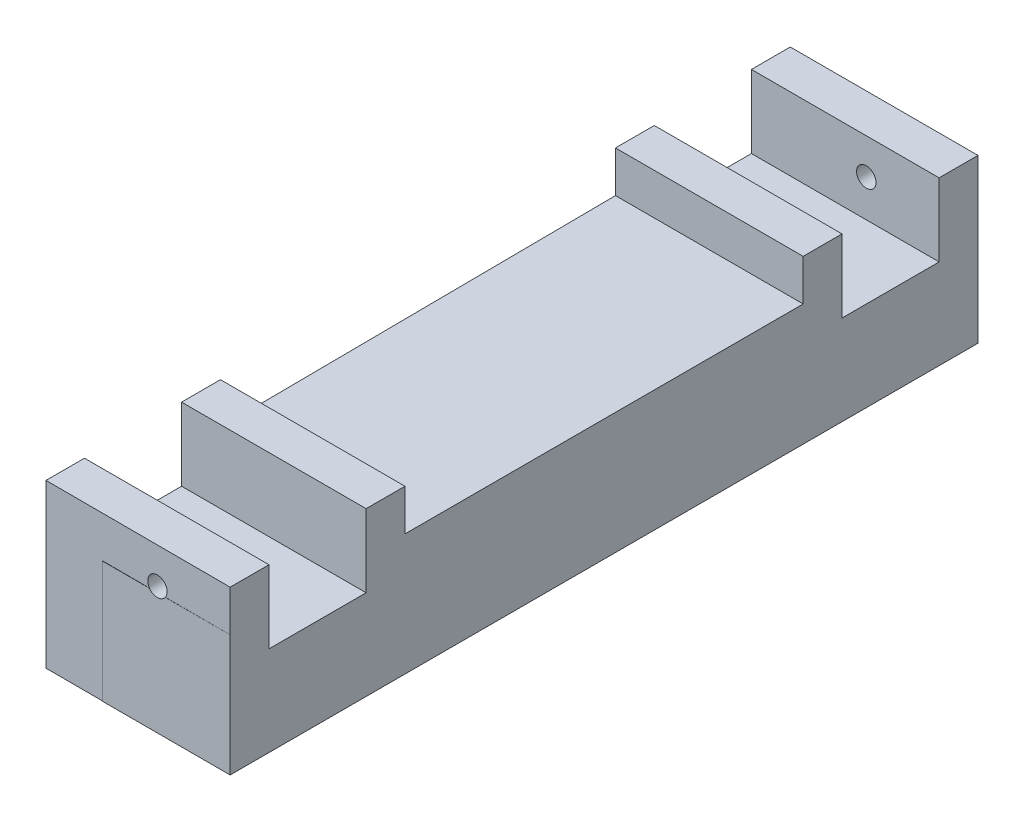
from build123d import *

# Parameters (mm, degrees)
EXTRUDE_1_DEPTH           = 30
SKETCH_2_W                = 20
SKETCH_2_H                = 15
SKETCH_2_W_2              = 70
SKETCH_2_H_2              = 10
EXTRUDE_4_DEPTH           = 70
SKETCH_5_R                = 2.8
CUT_EXTRUDE_3_DEPTH       = 5
SKETCH_6_R                = 2.8
CUT_EXTRUDE_4_DEPTH       = 5
PATTERN_LINEAR_1_COUNT    = 3
PATTERN_LINEAR_1_PITCH    = 19
SKETCH_14_W               = 30
SKETCH_14_H               = 20
EXTRUDE_16_DEPTH          = 8.5
EXTRUDE_17_DEPTH          = 8.5
EXTRUDE_18_DEPTH          = 8.5
SKETCH_15_W               = 140
SKETCH_15_H               = 160
EXTRUDE_21_DEPTH          = 10
SKETCH_17_W               = 140
SKETCH_17_H               = 160
EXTRUDE_22_DEPTH          = 15
CUT_EXTRUDE_8_REACH       = 328.336
SKETCH_20_R               = 2
CUT_EXTRUDE_10_REACH      = 267.273
CUT_EXTRUDE_11_REACH      = 267.358
SKETCH_22_R               = 2
SKETCH_23_R               = 2.8
CUT_EXTRUDE_12_DEPTH      = 5
SKETCH_24_R               = 1.9
CUT_EXTRUDE_13_DEPTH      = 5
CUT_EXTRUDE_16_DEPTH      = 251.685617404
CUT_EXTRUDE_16_DEPTH_BACK = 251.685617404
CUT_EXTRUDE_17_DEPTH      = 15


with BuildPart() as part:
    # 草图1 → 凸台-拉伸1 (new body)
    with BuildSketch(Plane(origin=(0, 0, 0), x_dir=(0, 0, -1), z_dir=(1, 0, 0))):
        Polygon((-20.255776875, 11.348042253), (-20.255776875, -3.651957747), (-0.255776875, -3.651957747), (-0.255776875, 11.348042253), (97.744223125, 11.348042253), (97.744223125, -3.651957747), (117.744223125, -3.651957747), (117.744223125, 11.348042253), (125.744223125, 11.348042253), (125.744223125, -13.651957747), (-28.255776875, -13.651957747), (-28.255776875, 11.348042253), align=None)
    extrude(amount=EXTRUDE_1_DEPTH)

    # 草图2 → 凸台-拉伸4 (add)
    with BuildSketch(Plane.ZY):
        Polygon((-125.744223125, 11.348042253), (-117.744223125, 11.348042253), (-117.744223125, 16.348042253), (-132.744223125, 16.348042253), (-132.744223125, -13.651957747), (-125.744223125, -13.651957747), align=None)
        Polygon((-117.744223125, -13.651957747), (-117.744223125, -3.651957747), (-117.744223125, 11.348042253), (-125.744223125, 11.348042253), (-125.744223125, -13.651957747), align=None)
        Polygon((-97.744223125, -3.651957747), (-117.744223125, -3.651957747), (-117.744223125, -13.651957747), (28.255776875, -13.651957747), (28.255776875, 11.348042253), (20.255776875, 11.348042253), (20.255776875, -3.651957747), (0.255776875, -3.651957747), (0.255776875, 11.348042253), (-97.744223125, 11.348042253), align=None)
        with Locations((-107.744223125, 3.848042253)):
            Rectangle(SKETCH_2_W, SKETCH_2_H)
        with Locations((10.255776875, 3.848042253)):
            Rectangle(SKETCH_2_W, SKETCH_2_H)
        Polygon((28.255776875, 11.348042253), (28.255776875, -13.651957747), (53.255776875, -13.651957747), (53.255776875, -3.651957747), (53.255776875, 11.348042253), align=None)
        with Locations((88.255776875, -8.651957747)):
            Rectangle(SKETCH_2_W_2, SKETCH_2_H_2)
    extrude(amount=EXTRUDE_4_DEPTH)

    # 草图5 → 切除-拉伸3 (cut)
    with BuildSketch(Plane(origin=(0, 16.348042253, 0), x_dir=(1, 0, 0), z_dir=(0, 1, 0))):
        with Locations(Location((-51, 125.244223125, 0), (0, 0, 270))):
            Circle(SKETCH_5_R)
        with Locations(Location((-19, 125.244223125, 0), (0, 0, 270))):
            Circle(SKETCH_5_R)
    extrude(amount=-CUT_EXTRUDE_3_DEPTH, mode=Mode.SUBTRACT)

    # 草图6 → 切除-拉伸4 (cut)
    with BuildSketch(Plane(origin=(0, -3.651957747, 0), x_dir=(1, 0, 0), z_dir=(0, 1, 0))):
        with Locations(Location((-55, -112.316244648, 0), (0, 0, 270))):
            Circle(SKETCH_6_R)
        with Locations(Location((-15, -112.316244648, 0), (0, 0, 270))):
            Circle(SKETCH_6_R)
    cut_extrude_4 = extrude(amount=-CUT_EXTRUDE_4_DEPTH, mode=Mode.SUBTRACT)

    # 阵列(线性)1: 切除-拉伸4 ×3
    with Locations(*[(0, 0, -i * PATTERN_LINEAR_1_PITCH) for i in range(1, PATTERN_LINEAR_1_COUNT)]):
        add(cut_extrude_4, mode=Mode.SUBTRACT)

    # 草图14 → 凸台-拉伸16 (add)
    with BuildSketch(Plane(origin=(0, -3.651957747, 0), x_dir=(1, 0, 0), z_dir=(0, 1, 0))):
        with Locations((15, -10.255776875)):
            Rectangle(SKETCH_14_W, SKETCH_14_H)
        with Locations((15, 107.744223125)):
            Rectangle(SKETCH_14_W, SKETCH_14_H)
    extrude(amount=EXTRUDE_16_DEPTH)

    # 草图9 → 凸台-拉伸17 (add)
    with BuildSketch(Plane(origin=(0, 11.348042253, 0), x_dir=(1, 0, 0), z_dir=(0, 1, 0))):
        Polygon((-8.658071854, 117.744223125), (-8.658071854, 125.744223125), (0, 125.744223125), (30, 125.744223125), (30, 117.744223125), (0, 117.744223125), (0, 97.744223125), (30, 97.744223125), (30, 89.744223125), (-8.658071854, 89.744223125), align=None)
    extrude(amount=EXTRUDE_17_DEPTH)

    # 草图13 → 凸台-拉伸18 (add)
    with BuildSketch(Plane(origin=(0, 11.348042253, 0), x_dir=(1, 0, 0), z_dir=(0, 1, 0))):
        Polygon((30, -0.255776875), (30, 7.744223125), (-8, 7.744223125), (-8, -28.176051311), (30, -28.255776875), (30, -20.255776875), (0, -20.255776875), (0, -0.255776875), align=None)
    extrude(amount=EXTRUDE_18_DEPTH)

    # 草图15 → 凸台-拉伸21 (add)
    with BuildSketch(Plane(origin=(0, -3.651957747, 0), x_dir=(1, 0, 0), z_dir=(0, 1, 0))):
        with Locations((-140, -43.255776875)):
            Rectangle(SKETCH_15_W, SKETCH_15_H)
    extrude(amount=-EXTRUDE_21_DEPTH)

    # 草图17 → 凸台-拉伸22 (add)
    with BuildSketch(Plane(origin=(0, -3.651957747, 0), x_dir=(1, 0, 0), z_dir=(0, 1, 0))):
        with Locations((-140, -43.255776875)):
            Rectangle(SKETCH_17_W, SKETCH_17_H)
    extrude(amount=EXTRUDE_22_DEPTH)

    # 草图20 → 切除-拉伸8 (cut, up to next)
    with BuildSketch(Plane(origin=(0, 0, -125.744223125), x_dir=(-1, 0, 0), z_dir=(0, 0, -1)), mode=Mode.PRIVATE) as cut_extrude_8_sk1:
        with Locations(Location((-15, 12.498042253, 0), (0, 0, 90))):
            Circle(SKETCH_20_R)
    cut_extrude_8_tool1 = extrude(cut_extrude_8_sk1.sketch, amount=-CUT_EXTRUDE_8_REACH, mode=Mode.PRIVATE) & part.part
    add(cut_extrude_8_tool1.solids().sort_by_distance((15, 12.498042, -125.744223))[0], mode=Mode.SUBTRACT)

    # 切除-拉伸10: up to this plane
    cut_extrude_10_end = Plane(origin=(30, 11.348042253, 20.255776875), z_dir=(0, 0, 1))
    # 草图21 → 切除-拉伸10 (cut, up to the surface)
    with BuildSketch(Plane(origin=(-0.059149469, 0, 28.192711542), x_dir=(0.9999977991189155, 0, 0.0020980365404790436), z_dir=(-0.0020980365404790436, 0, 0.9999977991189156)), mode=Mode.PRIVATE) as cut_extrude_10_sk1:
        with BuildLine():
            ThreePointArc((17.059215626, 12.498042253), (14.456145827, 14.404952533), (13.422908809, 11.348042253))
            Line((13.422908809, 11.348042253), (16.695522443, 11.348042253))
            ThreePointArc((16.695522443, 11.348042253), (16.966125906, 11.894972454), (17.059215626, 12.498042253))
        make_face()
    cut_extrude_10_tool1 = split(extrude(cut_extrude_10_sk1.sketch, amount=-CUT_EXTRUDE_10_REACH, mode=Mode.PRIVATE), bisect_by=cut_extrude_10_end, keep=Keep.BOTH, mode=Mode.PRIVATE)
    add(cut_extrude_10_tool1.solids().sort_by_distance((15.000033, 12.773192, 28.224306))[0], mode=Mode.SUBTRACT)

    # 草图22 → 切除-拉伸11 (cut, up to next)
    with BuildSketch(Plane.XY.offset(28.255776875), mode=Mode.PRIVATE) as cut_extrude_11_sk1:
        with Locations(Location((15, 12.498042253, 0), (0, 0, 90))):
            Circle(SKETCH_22_R)
    cut_extrude_11_tool1 = extrude(cut_extrude_11_sk1.sketch, amount=-CUT_EXTRUDE_11_REACH, mode=Mode.PRIVATE) & part.part
    add(cut_extrude_11_tool1.solids().sort_by_distance((15, 12.498042, 28.255777))[0], mode=Mode.SUBTRACT)

    # 草图23 → 切除-拉伸12 (cut)
    with BuildSketch(Plane(origin=(0, 11.348042253, 0), x_dir=(1, 0, 0), z_dir=(0, 1, 0))):
        with Locations(Location((-194, -93.255776875, 0), (0, 0, 270))):
            Circle(SKETCH_23_R)
        with Locations(Location((-86, -93.255776875, 0), (0, 0, 270))):
            Circle(SKETCH_23_R)
    extrude(amount=-CUT_EXTRUDE_12_DEPTH, mode=Mode.SUBTRACT)

    # 草图24 → 切除-拉伸13 (cut)
    with BuildSketch(Plane(origin=(0, 11.348042253, 0), x_dir=(1, 0, 0), z_dir=(0, 1, 0))):
        with Locations(Location((-196.5, 26.744223125, 0), (0, 0, 270))):
            Circle(SKETCH_24_R)
        with Locations(Location((-83.5, 26.744223125, 0), (0, 0, 270))):
            Circle(SKETCH_24_R)
        with Locations(Location((-196.5, -47.555776875, 0), (0, 0, 270))):
            Circle(SKETCH_24_R)
        with Locations(Location((-83.5, -47.555776875, 0), (0, 0, 270))):
            Circle(SKETCH_24_R)
    extrude(amount=-CUT_EXTRUDE_13_DEPTH, mode=Mode.SUBTRACT)

    # 草图26 → 切除-拉伸16 (cut, two sides: drawn at the far end of the back side and taken through both)
    with BuildSketch(Plane(origin=(0, 19.848042253, 0), x_dir=(1, 0, 0), z_dir=(0, 1, 0)).offset(-CUT_EXTRUDE_16_DEPTH_BACK)):
        Polygon((-8, 7.744223125), (-8.658071854, 89.744223125), (-8.658071854, 125.744223125), (3.217660612, 125.744223125), (3.802444891, 150.192522069), (-171.612640653, 166.525859149), (-482.190724596, -91.141473661), (-210.719247924, -353.972429265), (3.510052751, -124.506752876), (3.712106974, -28.200623793), (-8, -28.176051311), align=None)
    extrude(amount=CUT_EXTRUDE_16_DEPTH + CUT_EXTRUDE_16_DEPTH_BACK, mode=Mode.SUBTRACT)

    # 草图27 → 切除-拉伸17 (cut)
    with BuildSketch(Plane(origin=(0, 19.848042253, 0), x_dir=(1, 0, 0), z_dir=(0, 1, 0))):
        Polygon((-11.220288102, -0.255776875), (-9.170863609, -20.255776875), (0, -20.255776875), (0, -0.255776875), align=None)
        Polygon((-8.658071854, 97.744223125), (0, 97.744223125), (0, 117.744223125), (-8.658071854, 104.132040921), align=None)
        Polygon((-16.859481318, 117.744223125), (-12.721063711, 97.744223125), (-8.658071854, 104.132040921), (-8.658071854, 117.744223125), align=None)
        Polygon((-8.658071854, 104.132040921), (0, 117.744223125), (-8.658071854, 117.744223125), align=None)
    extrude(amount=-CUT_EXTRUDE_17_DEPTH, mode=Mode.SUBTRACT)


solid = part.part
